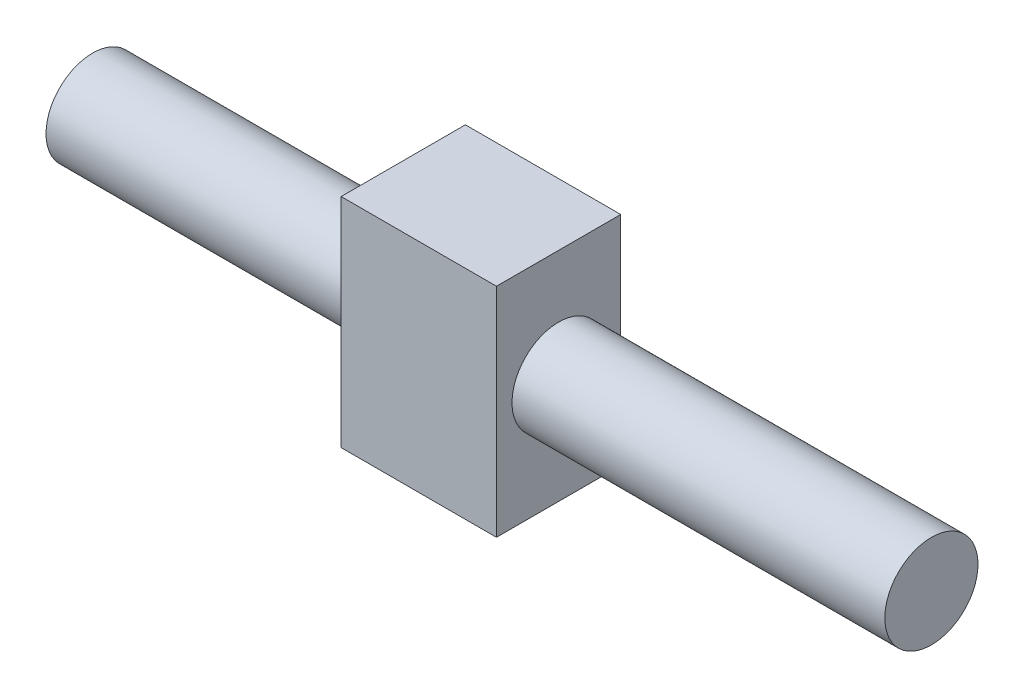
from build123d import *

# Parameters (mm, degrees)
SKETCH1_W           = 50
SKETCH1_H           = 70
BOSS_EXTRUDE1_DEPTH = 40
SKETCH3_R           = 15
BOSS_EXTRUDE3_DEPTH = 100
BOSS_EXTRUDE4_START = 120
SKETCH4_R           = 15
BOSS_EXTRUDE4_DEPTH = 120


with BuildPart() as part:
    # Sketch1 → Boss-Extrude1 (new body)
    with BuildSketch(Plane.XY):
        with Locations((-25, 35)):
            Rectangle(SKETCH1_W, SKETCH1_H)
    extrude(amount=BOSS_EXTRUDE1_DEPTH)

    # Sketch3 → Boss-Extrude3 (add)
    with BuildSketch(Plane.ZY.offset(50)):
        with Locations((20, 35)):
            Circle(SKETCH3_R)
    extrude(amount=BOSS_EXTRUDE3_DEPTH)

    # Sketch4 → Boss-Extrude4 (add)
    with BuildSketch(Plane(origin=(0, 0, 0), x_dir=(0, 0, -1), z_dir=(1, 0, 0)).offset(BOSS_EXTRUDE4_START)):
        with Locations(Location((-20, 35, 0), (0, 0, 180))):
            Circle(SKETCH4_R)
    extrude(amount=-BOSS_EXTRUDE4_DEPTH)


solid = part.part
